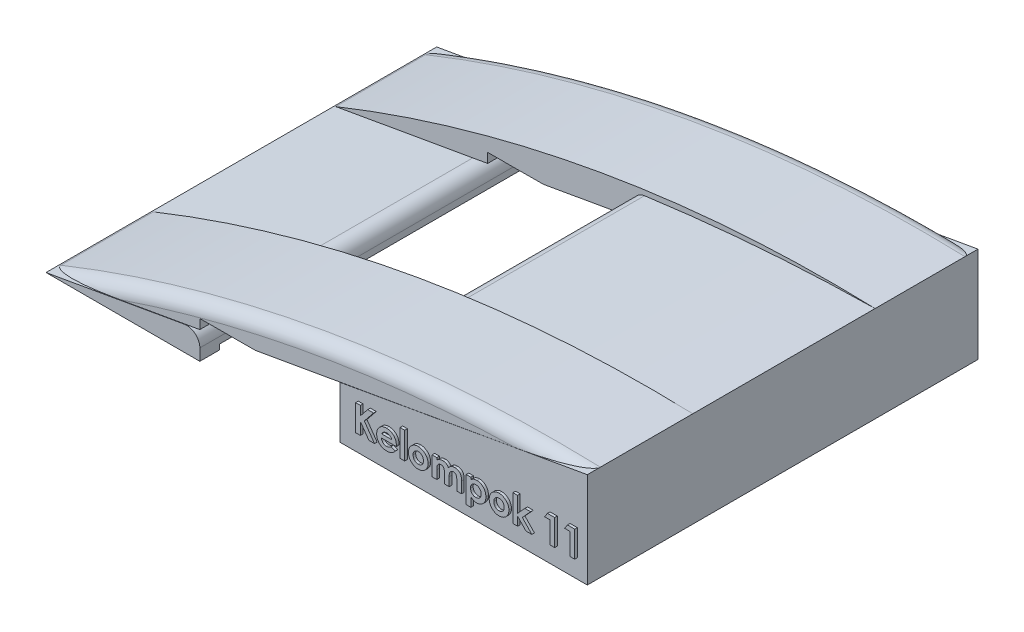
from build123d import *

# Parameters (mm, degrees)
BOSS_EXTRUDE2_DEPTH      = 150
BOSS_EXTRUDE2_DEPTH_BACK = 150
CUT_EXTRUDE2_DEPTH       = 135
CUT_EXTRUDE2_DEPTH_BACK  = 135
SKETCH3_W                = 234.9626354
SKETCH3_H                = 138.9202701
CUT_EXTRUDE3_DEPTH       = 135
CUT_EXTRUDE5_DEPTH       = 330
BOSS_EXTRUDE4_DEPTH      = 142
BOSS_EXTRUDE6_DEPTH      = 142
BOSS_EXTRUDE7_DEPTH      = 81
CUT_EXTRUDE6_DEPTH       = 300
BOSS_EXTRUDE8_DEPTH      = 79
CUT_EXTRUDE7_DEPTH       = 187
CUT_EXTRUDE7_DEPTH_BACK  = 212
BOSS_EXTRUDE9_DEPTH      = 186
FILLET1_R                = 10
FILLET2_R                = 10
FILLET3_R                = 10
FILLET4_R                = 10
SKETCH16_W               = 3.58974359
SKETCH16_H               = 20.512820513
BOSS_EXTRUDE11_DEPTH     = 2
SKETCH17_W               = 3.58974359
SKETCH17_H               = 20.512820513
BOSS_EXTRUDE12_DEPTH     = 2


with BuildPart() as part:
    # Sketch1 → Boss-Extrude2 (new, two sides: drawn at the far end of the back side and taken through both)
    with BuildSketch(Plane.XY.offset(-BOSS_EXTRUDE2_DEPTH_BACK)):
        Polygon((-209.307170195, -40.715866281), (206.361989113, -40.715866281), (206.361989113, 32.684133719), align=None)
    extrude(amount=BOSS_EXTRUDE2_DEPTH + BOSS_EXTRUDE2_DEPTH_BACK)

    # Sketch2 → Cut-Extrude2 (cut, two sides: drawn at the far end of the back side and taken through both)
    with BuildSketch(Plane.XY.offset(-CUT_EXTRUDE2_DEPTH_BACK)):
        Polygon((194.537370996, 15.364044392), (194.537370996, -28.035955608), (194.537370996, -40.715866281), (-112.107869233, -40.715866281), (-44.349609233, -28.035955608), align=None)
    extrude(amount=CUT_EXTRUDE2_DEPTH + CUT_EXTRUDE2_DEPTH_BACK, mode=Mode.SUBTRACT)

    # Sketch3 → Cut-Extrude3 (cut)
    with BuildSketch(Plane(origin=(0.643160465, -3.642261166, 0), x_dir=(0.9847646512869395, 0.17389244254915892, 0), z_dir=(-0.17389244254915892, 0.9847646512869396, 0))):
        with Locations((-95.717166207, 0.975734402)):
            Rectangle(SKETCH3_W, SKETCH3_H)
    extrude(amount=-CUT_EXTRUDE3_DEPTH, mode=Mode.SUBTRACT)

    # Sketch4 → Cut-Extrude5 (cut)
    with BuildSketch(Plane.XY.offset(150)):
        Polygon((-91.166181671, -19.854206561), (-91.166181671, -40.715866281), (16.315929345, -40.715866281), (16.315929345, -0.87472066), align=None)
    extrude(amount=-CUT_EXTRUDE5_DEPTH, mode=Mode.SUBTRACT)


with BuildPart() as cut_extrude5_piece_1:
    # of the separate pieces the step leaves, piece 1, a body of its own (cut_extrude5_pieces)
    add(part.part.solids().sort_by_distance((16.315929345, -40.715866281, 150))[0])

    # Sketch16 → Boss-Extrude11 (add)
    # profile 1 of 10: a face of its own
    with BuildSketch(Plane.XY.offset(150)):
        Polygon((30.467834805, -6.356957329), (34.057578395, -6.356957329), (34.057578395, -13.396220149), (39.730655318, -6.356957329), (44.261905318, -6.356957329), (37.134501472, -15.203111175), (44.955014293, -26.356957329), (40.632097626, -26.356957329), (34.057578395, -16.977950918), (34.057578395, -26.356957329), (30.467834805, -26.356957329), align=None)
    # profile 2 of 10: a face of its own
    with BuildSketch(Plane.XY.offset(150)):
        with BuildLine():
            Line((61.737866857, -19.946700918), (50.211424549, -19.946700918))
            add(Edge.make_bspline(
                [(50.211424549, -19.946700918), (50.234926034, -20.080631639), (50.281108307, -20.343816071), (50.381394753, -20.726114296), (50.509375299, -21.086385691), (50.662751924, -21.425111849), (50.838938699, -21.744083484), (51.044445977, -22.041804494), (51.276667082, -22.318011911), (51.534259376, -22.571505309), (51.812929262, -22.798640888), (52.111325295, -22.997626014), (52.4297554, -23.160781644), (52.764568897, -23.298304911), (53.118267612, -23.40723727), (53.491372101, -23.482365846), (53.88289332, -23.526744571), (54.149609536, -23.533163446), (54.28594378, -23.536444508)],
                knots=[0, 0, 0, 0, 1.091296461, 2.144483647, 3.168565212, 4.157007626, 5.126487748, 6.090021542, 7.05641414, 8.019231907, 8.98705074, 9.938580405, 10.892824166, 11.854447369, 12.841318655, 13.858982407, 14.905600794, 16, 16, 16, 16], degree=3))
            add(Edge.make_bspline(
                [(54.28594378, -23.536444508), (54.450508467, -23.532099841), (54.774584799, -23.523543913), (55.249359039, -23.447665537), (55.708534889, -23.333054586), (56.147766926, -23.16261848), (56.572142964, -22.95045549), (56.974676472, -22.68612651), (57.362334987, -22.377356096), (57.598852364, -22.139355979), (57.719437369, -22.018015021)],
                knots=[0, 0, 0, 0, 1.021034703, 2.010718019, 2.977989445, 3.954245119, 4.929443971, 5.918328161, 6.938689359, 8, 8, 8, 8], degree=3))
            Line((57.719437369, -22.018015021), (60.724245062, -23.448303482))
            add(Edge.make_bspline(
                [(60.724245062, -23.448303482), (60.629640445, -23.579032543), (60.442184877, -23.838067368), (60.136169952, -24.202596269), (59.816823892, -24.542716521), (59.48390853, -24.856191103), (59.137001644, -25.142126734), (58.777068247, -25.404006629), (58.398848059, -25.634799418), (58.009903524, -25.845670715), (57.602194438, -26.0264497), (57.176849115, -26.180611637), (56.735669128, -26.319972717), (56.273083328, -26.426158225), (55.792943663, -26.510213807), (55.294101545, -26.569904406), (54.776622719, -26.606772429), (54.424895376, -26.611143088), (54.245879677, -26.613367585)],
                knots=[0, 0, 0, 0, 1.028154879, 2.037251081, 3.030720504, 4.000128189, 4.949298328, 5.894184978, 6.834267904, 7.770992897, 8.712077017, 9.673380525, 10.653304757, 11.658697181, 12.695551717, 13.758623199, 14.859225354, 16, 16, 16, 16], degree=3))
            add(Edge.make_bspline(
                [(54.245879677, -26.613367585), (53.970466963, -26.607752748), (53.431087037, -26.596756414), (52.642146389, -26.494694698), (51.892871595, -26.32546537), (51.181146963, -26.095424091), (50.510049042, -25.791697535), (49.879245703, -25.420214762), (49.282434319, -24.988097841), (48.73785081, -24.486277787), (48.241719166, -23.940076491), (47.805947978, -23.353493598), (47.441300852, -22.73062734), (47.141845299, -22.075599977), (46.909098041, -21.386734895), (46.741300768, -20.663731488), (46.638439029, -19.906935075), (46.62732945, -19.391472237), (46.621680959, -19.129393226)],
                knots=[0, 0, 0, 0, 1.103565453, 2.161269334, 3.182010356, 4.179077853, 5.15417608, 6.128274628, 7.109042802, 8.101804412, 9.090965879, 10.063106201, 11.02526161, 11.978650795, 12.945248442, 13.93468508, 14.949922959, 16, 16, 16, 16], degree=3))
            add(Edge.make_bspline(
                [(46.621680959, -19.129393226), (46.627385044, -18.860654451), (46.638607573, -18.331922981), (46.740415129, -17.557651793), (46.909561943, -16.818892354), (47.142990038, -16.114627316), (47.437902813, -15.442654039), (47.807189448, -14.808851484), (48.241502916, -14.211013095), (48.735847256, -13.651935621), (49.282737789, -13.147307121), (49.863860649, -12.697582281), (50.485745348, -12.322841693), (51.141357833, -12.02005153), (51.826504571, -11.774042166), (52.5491049, -11.610343481), (53.303660933, -11.500429612), (53.819458822, -11.490307231), (54.081616857, -11.485162457)],
                knots=[0, 0, 0, 0, 1.079208495, 2.12329425, 3.130605359, 4.119693003, 5.099659317, 6.073216462, 7.060498243, 8.06384408, 9.066070512, 10.045757761, 11.010926815, 11.975797609, 12.942977511, 13.929384301, 14.947594487, 16, 16, 16, 16], degree=3))
            add(Edge.make_bspline(
                [(54.081616857, -11.485162457), (54.358348984, -11.490864403), (54.901683997, -11.502059588), (55.696119373, -11.603292587), (56.450369262, -11.773553855), (57.16764719, -12.00160601), (57.838793224, -12.313005017), (58.478554478, -12.675346188), (59.071585849, -13.116803644), (59.624208419, -13.616167953), (60.12306323, -14.170195347), (60.559117609, -14.772038784), (60.930146216, -15.415824625), (61.230868585, -16.104163559), (61.463376855, -16.834989124), (61.631329454, -17.6073522), (61.733406603, -18.424190485), (61.744309458, -18.983526475), (61.749886087, -19.269617585)],
                knots=[0, 0, 0, 0, 1.080001299, 2.120471247, 3.119684163, 4.095710327, 5.052285597, 6.002875087, 6.961153713, 7.931888285, 8.906493152, 9.865905668, 10.82813294, 11.801621613, 12.7925306, 13.817193356, 14.883530496, 16, 16, 16, 16], degree=3))
            Line((61.749886087, -19.269617585), (61.737866857, -19.946700918))
        make_face()
        with BuildLine():
            add(Edge.make_bspline(
                [(58.160142498, -17.126188098), (58.092401841, -16.943383505), (57.957715768, -16.579920353), (57.653465535, -16.07842989), (57.249735211, -15.644118781), (56.780167879, -15.259619713), (56.243657802, -14.947536251), (55.657111348, -14.72157769), (55.027942355, -14.586090101), (54.595107991, -14.570199787), (54.374084805, -14.562085534)],
                knots=[0, 0, 0, 0, 0.954238005, 1.897273737, 2.851915805, 3.847685534, 4.862635127, 5.880135777, 6.917509367, 8, 8, 8, 8], degree=3))
            add(Edge.make_bspline(
                [(54.374084805, -14.562085534), (54.1326915, -14.569880262), (53.660817853, -14.585117333), (52.980172242, -14.747169179), (52.33813627, -14.989026719), (51.959628249, -15.238386978), (51.769918139, -15.363367585)],
                knots=[0, 0, 0, 0, 1.044195649, 2.041185066, 3.018232172, 4, 4, 4, 4], degree=3))
            add(Edge.make_bspline(
                [(51.769918139, -15.363367585), (51.651553198, -15.458555553), (51.399205197, -15.661491434), (51.07148012, -16.066329252), (50.748668192, -16.556496968), (50.565131813, -16.928813978), (50.467834805, -17.126188098)],
                knots=[0, 0, 0, 0, 0.82159062, 1.751589201, 2.808063854, 4, 4, 4, 4], degree=3))
            Line((50.467834805, -17.126188098), (58.160142498, -17.126188098))
        make_face(mode=Mode.SUBTRACT)
    # profile 3 of 10: a face of its own
    with BuildSketch(Plane.XY.offset(150)):
        with Locations((66.365270703, -16.100547072)):
            Rectangle(SKETCH16_W, SKETCH16_H)
    # profile 4 of 10: a face of its own
    with BuildSketch(Plane.XY.offset(150)):
        with BuildLine():
            add(Edge.make_bspline(
                [(78.456616857, -11.485162457), (78.626333003, -11.488182672), (78.962447876, -11.494164066), (79.46304899, -11.54395371), (79.954898443, -11.625187568), (80.440823319, -11.730371233), (80.916311351, -11.877749281), (81.383856418, -12.05450646), (81.847638965, -12.257444373), (82.296148003, -12.499011473), (82.732623675, -12.761013023), (83.146428587, -13.050022231), (83.534126377, -13.363769026), (83.902914034, -13.694978943), (84.235605458, -14.05807178), (84.553461418, -14.435552203), (84.839308928, -14.840944017), (85.103962547, -15.264368761), (85.33958176, -15.703377853), (85.544173714, -16.15491739), (85.721740294, -16.612744517), (85.860771368, -17.082435883), (85.975876282, -17.557797982), (86.048515665, -18.044656023), (86.100157229, -18.53800875), (86.105947885, -18.870174404), (86.108860446, -19.03724579)],
                knots=[0, 0, 0, 0, 1.022364134, 2.024744242, 3.027414945, 4.024939316, 5.017584196, 6.023349371, 7.035562955, 8.064994934, 9.090267829, 10.101425541, 11.102933353, 12.093946398, 13.084502048, 14.067315274, 15.065326281, 16.070028806, 17.074376865, 18.064572984, 19.055292013, 20.030201733, 21.013838017, 21.999348303, 22.993720005, 24, 24, 24, 24], degree=3))
            add(Edge.make_bspline(
                [(86.108860446, -19.03724579), (86.10578672, -19.205622422), (86.099675455, -19.540393335), (86.050383993, -20.038386654), (85.968839198, -20.527534161), (85.863251833, -21.010717508), (85.716425316, -21.481753903), (85.544874202, -21.947586606), (85.334288462, -22.401866145), (85.101470409, -22.849548281), (84.835115179, -23.277459095), (84.549515102, -23.686911957), (84.23299048, -24.067164993), (83.902962342, -24.43001091), (83.543776708, -24.763179881), (83.161166851, -25.072081683), (82.758445109, -25.360492778), (82.332715488, -25.621646498), (81.889430874, -25.851112959), (81.436067179, -26.0579957), (80.969973384, -26.230240353), (80.492114095, -26.370701125), (80.002199507, -26.479456384), (79.501311224, -26.553335126), (78.990527975, -26.604716939), (78.646382334, -26.610465473), (78.472642498, -26.613367585)],
                knots=[0, 0, 0, 0, 1.012026251, 2.012137606, 3.004615893, 3.992048833, 4.982446996, 5.968083444, 6.973977695, 7.990229942, 8.999482246, 10.001782172, 10.988562221, 11.971415814, 12.948383116, 13.930088534, 14.925840678, 15.924049238, 16.929462851, 17.924729459, 18.917889337, 19.913673841, 20.916777188, 21.931792057, 22.95587778, 24, 24, 24, 24], degree=3))
            add(Edge.make_bspline(
                [(78.472642498, -26.613367585), (78.218599429, -26.60591092), (77.717876672, -26.59121372), (76.980430434, -26.490541743), (76.271988034, -26.317258876), (75.591395075, -26.075706381), (74.937767449, -25.766165859), (74.316809495, -25.383062459), (73.722344374, -24.933938386), (73.164668671, -24.422589678), (72.653762179, -23.861593841), (72.207423889, -23.262734204), (71.828446561, -22.634986665), (71.51717116, -21.97763538), (71.276930025, -21.289778945), (71.103434936, -20.573473809), (71.002639876, -19.826706542), (70.988066979, -19.319331319), (70.980655318, -19.061284252)],
                knots=[0, 0, 0, 0, 1.029999031, 2.030143771, 3.011211297, 3.982305373, 4.953580601, 5.938004764, 6.935448627, 7.970290061, 9.001484052, 10.007591832, 10.993831261, 11.969999897, 12.951306496, 13.942897864, 14.953773953, 16, 16, 16, 16], degree=3))
            add(Edge.make_bspline(
                [(70.980655318, -19.061284252), (70.988325446, -18.785746551), (71.003400929, -18.244182716), (71.1231069, -17.450779357), (71.314264422, -16.691133242), (71.588659003, -15.967369341), (71.939173948, -15.27815277), (72.367073257, -14.624937164), (72.874471637, -14.00757456), (73.263037193, -13.634172493), (73.460623267, -13.444297072)],
                knots=[0, 0, 0, 0, 1.043912699, 2.05178951, 3.033892, 4.007821512, 4.978932272, 5.95884105, 6.962068106, 8, 8, 8, 8], degree=3))
            add(Edge.make_bspline(
                [(73.460623267, -13.444297072), (73.64192824, -13.286911706), (73.99960542, -12.976422959), (74.580713117, -12.582618885), (75.175701826, -12.242492308), (75.791702743, -11.962845002), (76.430433118, -11.751995445), (77.088619823, -11.598515832), (77.766125995, -11.504244156), (78.225283572, -11.491555347), (78.456616857, -11.485162457)],
                knots=[0, 0, 0, 0, 1.048115528, 2.067714963, 3.060638214, 4.039924844, 5.017819947, 5.994373833, 6.98952318, 8, 8, 8, 8], degree=3))
        make_face()
        with BuildLine():
            add(Edge.make_bspline(
                [(78.536745062, -14.81849579), (78.397760041, -14.823115192), (78.124166532, -14.832208534), (77.721429697, -14.881010072), (77.340516958, -14.981033016), (76.973862678, -15.108234825), (76.627953006, -15.278349323), (76.293314708, -15.477422489), (75.987348241, -15.726538058), (75.695246908, -15.999799614), (75.430084006, -16.303249237), (75.204140035, -16.633857375), (75.002254092, -16.978975652), (74.849174218, -17.35123928), (74.722485989, -17.740473212), (74.636744915, -18.152966285), (74.577075114, -18.584110727), (74.572645477, -18.879447625), (74.570398908, -19.02923297)],
                knots=[0, 0, 0, 0, 1.030650113, 2.02884584, 2.99876339, 3.944280128, 4.900564847, 5.851248946, 6.823638398, 7.81794922, 8.81432732, 9.802856497, 10.78262424, 11.771747962, 12.779760563, 13.812642396, 14.89064281, 16, 16, 16, 16], degree=3))
            add(Edge.make_bspline(
                [(74.570398908, -19.02923297), (74.573027699, -19.184300499), (74.578165167, -19.487350206), (74.631364721, -19.92984353), (74.71909254, -20.349766762), (74.843726277, -20.746471211), (75.000474245, -21.122804372), (75.192785825, -21.476654762), (75.42269065, -21.805894816), (75.683346921, -22.110119098), (75.968754405, -22.386266846), (76.281481613, -22.62324651), (76.608432708, -22.829150386), (76.957142416, -22.994522978), (77.322658062, -23.122204037), (77.706064709, -23.216211306), (78.10937716, -23.266857865), (78.384372513, -23.275581728), (78.524725831, -23.280034252)],
                knots=[0, 0, 0, 0, 1.141730614, 2.231293227, 3.276944405, 4.297399982, 5.28939179, 6.275415646, 7.257752684, 8.24146775, 9.222424823, 10.176631434, 11.126518621, 12.063689483, 13.012557477, 13.974037417, 14.965980454, 16, 16, 16, 16], degree=3))
            add(Edge.make_bspline(
                [(78.524725831, -23.280034252), (78.665149346, -23.276085065), (78.940460955, -23.268342366), (79.344247021, -23.210361778), (79.729611624, -23.119111762), (80.098249059, -22.990331796), (80.447178858, -22.821419492), (80.777736754, -22.614530545), (81.092830708, -22.374254707), (81.382068388, -22.092896576), (81.649810177, -21.787723527), (81.884603712, -21.456745438), (82.080806044, -21.102894957), (82.241727089, -20.728398515), (82.366605151, -20.333770854), (82.452880618, -19.917545193), (82.512582321, -19.481011445), (82.516911778, -19.18168562), (82.519116857, -19.02923297)],
                knots=[0, 0, 0, 0, 1.031504075, 2.022346795, 2.991027682, 3.937587355, 4.885570121, 5.833146507, 6.798790848, 7.791235734, 8.792807298, 9.778388351, 10.766749885, 11.760164525, 12.768777521, 13.802286646, 14.880660483, 16, 16, 16, 16], degree=3))
            add(Edge.make_bspline(
                [(82.519116857, -19.02923297), (82.516454624, -18.876833602), (82.51123046, -18.577776606), (82.458027114, -18.140652453), (82.371160232, -17.725772149), (82.244918994, -17.3349072), (82.089102714, -16.963598454), (81.896658209, -16.613746503), (81.665619566, -16.287074457), (81.403696172, -15.985202138), (81.114010252, -15.712929371), (80.806712742, -15.470128159), (80.474776694, -15.269312903), (80.124429426, -15.103769446), (79.754738833, -14.976407387), (79.366119953, -14.881867354), (78.95738179, -14.831941474), (78.678422691, -14.823024526), (78.536745062, -14.81849579)],
                knots=[0, 0, 0, 0, 1.123894411, 2.205445421, 3.243160173, 4.246488011, 5.231014757, 6.210004299, 7.185865357, 8.177612767, 9.153374344, 10.115157457, 11.061423229, 12.009021698, 12.96873347, 13.94135618, 14.954456845, 16, 16, 16, 16], degree=3))
        make_face(mode=Mode.SUBTRACT)
    # profile 5 of 10: a face of its own
    with BuildSketch(Plane.XY.offset(150)):
        with BuildLine():
            Line((89.185783523, -11.741572713), (92.775527113, -11.741572713))
            Line((92.775527113, -11.741572713), (92.775527113, -13.488367585))
            add(Edge.make_bspline(
                [(92.775527113, -13.488367585), (92.935197084, -13.327214699), (93.249574133, -13.009917913), (93.770558402, -12.60200437), (94.313997749, -12.253187895), (94.886477796, -11.970799005), (95.486598281, -11.755174693), (96.111514947, -11.597168377), (96.764437624, -11.503949599), (97.20898972, -11.491494256), (97.434982241, -11.485162457)],
                knots=[0, 0, 0, 0, 1.041528618, 2.050684245, 3.032913108, 4.004406485, 4.976926473, 5.95771665, 6.961784757, 8, 8, 8, 8], degree=3))
            add(Edge.make_bspline(
                [(97.434982241, -11.485162457), (97.661273152, -11.492280314), (98.106719489, -11.506291585), (98.756622596, -11.634507844), (99.372301954, -11.842815942), (99.946983642, -12.13973354), (100.484821123, -12.50641134), (100.961987843, -12.961793072), (101.391495232, -13.487750978), (101.620439205, -13.88538081), (101.737866857, -14.089329123)],
                knots=[0, 0, 0, 0, 1.023965777, 2.015643508, 2.987309376, 3.958410333, 4.93654923, 5.924956801, 6.93568961, 8, 8, 8, 8], degree=3))
            add(Edge.make_bspline(
                [(101.737866857, -14.089329123), (101.889128846, -13.884825992), (102.186013683, -13.483443735), (102.712269098, -12.959393689), (103.281308209, -12.506363856), (103.904140617, -12.137026467), (104.564226048, -11.843829421), (105.258676054, -11.635281823), (105.981194515, -11.506505869), (106.472907979, -11.492336032), (106.721841216, -11.485162457)],
                knots=[0, 0, 0, 0, 1.041189987, 2.043563759, 3.033412161, 4.015238574, 5.00275396, 5.986226558, 6.980513695, 8, 8, 8, 8], degree=3))
            add(Edge.make_bspline(
                [(106.721841216, -11.485162457), (106.978959688, -11.492611108), (107.479674012, -11.507116665), (108.20528097, -11.649825949), (108.884899692, -11.870333206), (109.503510793, -12.191225233), (110.062878614, -12.571334548), (110.539527475, -13.020449565), (110.935102479, -13.522898743), (111.192672533, -13.992063678), (111.359184653, -14.406859206), (111.45972615, -14.767809035), (111.553763557, -15.170855173), (111.621320024, -15.621415125), (111.684381005, -16.115253976), (111.720990384, -16.655654934), (111.745874158, -17.240797513), (111.74851713, -17.645654478), (111.749886087, -17.855354764)],
                knots=[0, 0, 0, 0, 1.321991808, 2.574456155, 3.791773975, 4.987670122, 6.148905103, 7.262530793, 8.344737981, 9.427709016, 10.004683293, 10.642050061, 11.354108788, 12.133887687, 12.985666279, 13.916212488, 14.92067847, 16, 16, 16, 16], degree=3))
            Line((111.749886087, -17.855354764), (111.749886087, -26.356957329))
            Line((111.749886087, -26.356957329), (108.160142498, -26.356957329))
            Line((108.160142498, -26.356957329), (108.160142498, -19.017213739))
            add(Edge.make_bspline(
                [(108.160142498, -19.017213739), (108.157154716, -18.820889241), (108.151419939, -18.444062108), (108.127039194, -17.90357553), (108.072464655, -17.413400844), (108.008496303, -16.970822943), (107.916956357, -16.578188425), (107.805340016, -16.234550795), (107.675865737, -15.939415399), (107.519529448, -15.692812997), (107.34443262, -15.485134822), (107.149662659, -15.307113498), (106.937250339, -15.155226081), (106.705269829, -15.025763643), (106.447643836, -14.938205633), (106.173069406, -14.869504495), (105.879397911, -14.822718528), (105.676353506, -14.819929285), (105.572001472, -14.81849579)],
                knots=[0, 0, 0, 0, 1.669139205, 3.203761885, 4.596586177, 5.860166715, 7.002923539, 8.018877315, 8.928339525, 9.734594377, 10.491888885, 11.231098709, 11.971440889, 12.708030942, 13.480072485, 14.275788656, 15.113863979, 16, 16, 16, 16], degree=3))
            add(Edge.make_bspline(
                [(105.572001472, -14.81849579), (105.411196465, -14.824055236), (105.095648638, -14.834964542), (104.635831141, -14.93921518), (104.203139489, -15.109653814), (103.799194721, -15.34152048), (103.432688833, -15.631117564), (103.112088958, -15.97460732), (102.847318172, -16.373969307), (102.66403738, -16.744497124), (102.549509907, -17.079528723), (102.468721184, -17.366456382), (102.405749586, -17.690929123), (102.356461262, -18.049660789), (102.30917487, -18.444679325), (102.285976431, -18.875485217), (102.262237349, -19.341479971), (102.262546382, -19.663542296), (102.2627066, -19.830515021)],
                knots=[0, 0, 0, 0, 1.129913425, 2.217230253, 3.297175357, 4.391411011, 5.481605898, 6.571841268, 7.681894157, 8.841607612, 9.468549532, 10.170608623, 10.93710061, 11.791434153, 12.717934886, 13.734733707, 14.825576123, 16, 16, 16, 16], degree=3))
            Line((102.2627066, -19.830515021), (102.2627066, -26.356957329))
            Line((102.2627066, -26.356957329), (98.67296301, -26.356957329))
            Line((98.67296301, -26.356957329), (98.67296301, -19.34974579))
            add(Edge.make_bspline(
                [(98.67296301, -19.34974579), (98.672661615, -19.193475747), (98.672081827, -18.892862802), (98.654654554, -18.458771957), (98.631577441, -18.057948591), (98.599226015, -17.689274737), (98.561915016, -17.353208935), (98.508066646, -17.051589697), (98.451493965, -16.782755011), (98.354499338, -16.47736683), (98.217821437, -16.138945617), (98.013622655, -15.780068765), (97.766718438, -15.479593978), (97.483349275, -15.235182921), (97.163129962, -15.048961309), (96.814172652, -14.910435573), (96.42981422, -14.835663633), (96.165247573, -14.824339168), (96.028732241, -14.81849579)],
                knots=[0, 0, 0, 0, 1.256487322, 2.417074606, 3.49288742, 4.484586665, 5.393016842, 6.210437544, 6.947749329, 7.599905853, 8.784490193, 9.876739139, 10.906602197, 11.896672079, 12.869113195, 13.872201355, 14.902064413, 16, 16, 16, 16], degree=3))
            add(Edge.make_bspline(
                [(96.028732241, -14.81849579), (95.874481664, -14.823731322), (95.568987105, -14.834100337), (95.123987611, -14.945472033), (94.698526826, -15.112783438), (94.301964453, -15.351117215), (93.940979999, -15.647529402), (93.623590011, -16.000789434), (93.360210697, -16.410478288), (93.176116355, -16.791226589), (93.06325883, -17.134616763), (92.980297815, -17.42899477), (92.91966916, -17.760613131), (92.869083913, -18.125748363), (92.822077473, -18.524831466), (92.798783047, -18.959617451), (92.775067422, -19.429624397), (92.775370189, -19.754355024), (92.775527113, -19.922662457)],
                knots=[0, 0, 0, 0, 1.07893236, 2.136834559, 3.195274846, 4.273923004, 5.364443877, 6.458052972, 7.587287137, 8.767908, 9.410170275, 10.118584836, 10.909717261, 11.770069756, 12.702352573, 13.724628867, 14.820678298, 16, 16, 16, 16], degree=3))
            Line((92.775527113, -19.922662457), (92.775527113, -26.356957329))
            Line((92.775527113, -26.356957329), (89.185783523, -26.356957329))
            Line((89.185783523, -26.356957329), (89.185783523, -11.741572713))
        make_face()
    # profile 6 of 10: a face of its own
    with BuildSketch(Plane.XY.offset(150)):
        with BuildLine():
            Line((118.929373267, -11.741572713), (118.929373267, -13.388207329))
            add(Edge.make_bspline(
                [(118.929373267, -13.388207329), (119.096029289, -13.23508679), (119.423324518, -12.934373851), (119.959195351, -12.549371527), (120.509883522, -12.21871427), (121.085507343, -11.95275985), (121.678167146, -11.74320882), (122.293173506, -11.595968718), (122.926004871, -11.498859919), (123.356096038, -11.48975173), (123.572802754, -11.485162457)],
                knots=[0, 0, 0, 0, 1.054376801, 2.070687235, 3.070225973, 4.045259405, 5.022040922, 5.996139433, 6.99033025, 8, 8, 8, 8], degree=3))
            add(Edge.make_bspline(
                [(123.572802754, -11.485162457), (123.808214224, -11.490801155), (124.271898433, -11.501907561), (124.954121521, -11.605601814), (125.607909166, -11.773216439), (126.235754432, -12.007252139), (126.834312228, -12.311108408), (127.41030778, -12.67491892), (127.953807366, -13.11369649), (128.465075199, -13.61068566), (128.93801068, -14.155422708), (129.349377452, -14.747667493), (129.692030008, -15.379624937), (129.982444886, -16.043823982), (130.194401328, -16.75128015), (130.357759669, -17.492503389), (130.448792104, -18.273764606), (130.461404961, -18.805989597), (130.467834805, -19.077309893)],
                knots=[0, 0, 0, 0, 0.985987466, 1.942075377, 2.884088208, 3.810275091, 4.743821533, 5.692411115, 6.659945104, 7.665215984, 8.677116751, 9.678438675, 10.680260931, 11.685531812, 12.710472044, 13.769734641, 14.863044265, 16, 16, 16, 16], degree=3))
            add(Edge.make_bspline(
                [(130.467834805, -19.077309893), (130.461749386, -19.339342171), (130.449753682, -19.855865567), (130.352835958, -20.614164415), (130.188568532, -21.338554779), (129.958134624, -22.029297542), (129.665191045, -22.688575571), (129.307633186, -23.315934585), (128.883375337, -23.909183235), (128.398339133, -24.460329862), (127.868366594, -24.959434105), (127.316173196, -25.407229842), (126.730761063, -25.774163333), (126.126764189, -26.084066777), (125.494667334, -26.321043944), (124.838787998, -26.487073084), (124.160164933, -26.598073865), (123.698783904, -26.608218904), (123.464629677, -26.613367585)],
                knots=[0, 0, 0, 0, 1.098553145, 2.165490463, 3.199345634, 4.208780719, 5.21409072, 6.219899742, 7.23156933, 8.267303578, 9.293302409, 10.281606823, 11.243293419, 12.184993323, 13.124258899, 14.066907486, 15.018941492, 16, 16, 16, 16], degree=3))
            add(Edge.make_bspline(
                [(123.464629677, -26.613367585), (123.255971162, -26.608307202), (122.844926443, -26.598338554), (122.24049475, -26.509455392), (121.656606872, -26.376694161), (121.092490441, -26.176873708), (120.541803782, -25.911713647), (119.995168014, -25.581504734), (119.451319113, -25.178098338), (119.107088037, -24.866951044), (118.929373267, -24.706316303)],
                knots=[0, 0, 0, 0, 0.990856396, 1.951927477, 2.896945079, 3.83213376, 4.788585491, 5.796263726, 6.862286081, 8, 8, 8, 8], degree=3))
            Line((118.929373267, -24.706316303), (118.929373267, -31.741572713))
            Line((118.929373267, -31.741572713), (115.339629677, -31.741572713))
            Line((115.339629677, -31.741572713), (115.339629677, -11.741572713))
            Line((115.339629677, -11.741572713), (118.929373267, -11.741572713))
        make_face()
        with BuildLine():
            add(Edge.make_bspline(
                [(122.795559164, -14.81849579), (122.64987666, -14.822975627), (122.364259756, -14.831758543), (121.944922121, -14.882093397), (121.547592327, -14.976798792), (121.1662293, -15.099546682), (120.805662191, -15.265237053), (120.462941151, -15.466087843), (120.141001621, -15.705587078), (119.838172741, -15.974250884), (119.566056917, -16.27649817), (119.324305612, -16.599465072), (119.123740702, -16.947357228), (118.956547989, -17.315763405), (118.830408392, -17.708669721), (118.736849356, -18.122733715), (118.68600595, -18.55922431), (118.67737942, -18.856836425), (118.67296301, -19.009200918)],
                knots=[0, 0, 0, 0, 1.060469436, 2.079096586, 3.066888298, 4.028858836, 4.99004353, 5.948472697, 6.914558426, 7.905691313, 8.889602648, 9.869280844, 10.836099585, 11.806137001, 12.808075328, 13.83377171, 14.890985086, 16, 16, 16, 16], degree=3))
            add(Edge.make_bspline(
                [(118.67296301, -19.009200918), (118.677434991, -19.164231914), (118.686211447, -19.468486919), (118.736631007, -19.914285091), (118.829533354, -20.336644699), (118.958329689, -20.736523342), (119.122677393, -21.113972902), (119.323004672, -21.470392638), (119.567417033, -21.797968231), (119.836543564, -22.108184475), (120.14124491, -22.38044306), (120.461734095, -22.624621559), (120.805578927, -22.82577174), (121.1678692, -22.988750933), (121.545855885, -23.12418575), (121.945171707, -23.215698916), (122.364193529, -23.266967253), (122.64985429, -23.275620536), (122.795559164, -23.280034252)],
                knots=[0, 0, 0, 0, 1.117193555, 2.192540452, 3.22680955, 4.227918444, 5.21468246, 6.188555072, 7.166222992, 8.154674427, 9.142376254, 10.104580718, 11.053462639, 12.005072638, 12.963662044, 13.941614018, 14.950094269, 16, 16, 16, 16], degree=3))
            add(Edge.make_bspline(
                [(122.795559164, -23.280034252), (122.935964069, -23.275934044), (123.21388524, -23.267817986), (123.620530996, -23.21118698), (124.011418878, -23.118646287), (124.383487717, -22.986742324), (124.739002441, -22.815003499), (125.081199555, -22.614040647), (125.398265127, -22.362952568), (125.702638169, -22.086985333), (125.974970724, -21.775773662), (126.219285756, -21.445152251), (126.424517644, -21.092170237), (126.587466925, -20.715657078), (126.722181742, -20.322744482), (126.814155798, -19.906240788), (126.864758237, -19.469863591), (126.873602735, -19.17225371), (126.878091216, -19.021220149)],
                knots=[0, 0, 0, 0, 1.021711385, 2.02240246, 2.981887075, 3.941027022, 4.888772411, 5.852236371, 6.822344989, 7.82661704, 8.838806642, 9.826383926, 10.814965113, 11.80282933, 12.807900643, 13.833672313, 14.900613836, 16, 16, 16, 16], degree=3))
            add(Edge.make_bspline(
                [(126.878091216, -19.021220149), (126.873531056, -18.871545381), (126.864546266, -18.576644183), (126.814980057, -18.143900839), (126.719464861, -17.733452393), (126.598864767, -17.341945779), (126.430375627, -16.974477396), (126.231154206, -16.626700148), (125.996733294, -16.297563949), (125.724794937, -15.995953865), (125.426526489, -15.721510357), (125.108129999, -15.47876281), (124.770855843, -15.272115484), (124.410111082, -15.109150661), (124.034408725, -14.975065732), (123.638007256, -14.882706261), (123.222921942, -14.831589363), (122.939926709, -14.822918934), (122.795559164, -14.81849579)],
                knots=[0, 0, 0, 0, 1.094680664, 2.156827393, 3.177782763, 4.17210342, 5.146667393, 6.126451192, 7.099203661, 8.094961544, 9.09004898, 10.058676268, 11.018205477, 11.974998356, 12.947750825, 13.930643515, 14.944335875, 16, 16, 16, 16], degree=3))
        make_face(mode=Mode.SUBTRACT)
    # profile 7 of 10: a face of its own
    with BuildSketch(Plane.XY.offset(150)):
        with BuildLine():
            add(Edge.make_bspline(
                [(140.507898908, -11.485162457), (140.677615055, -11.488182672), (141.013729928, -11.494164066), (141.514331042, -11.54395371), (142.006180494, -11.625187568), (142.49210537, -11.730371233), (142.967593403, -11.877749281), (143.435138469, -12.05450646), (143.898921017, -12.257444373), (144.347430055, -12.499011473), (144.783905726, -12.761013023), (145.197710639, -13.050022231), (145.585408428, -13.363769026), (145.954196085, -13.694978943), (146.28688751, -14.05807178), (146.604743469, -14.435552203), (146.890590979, -14.840944017), (147.155244598, -15.264368761), (147.390863811, -15.703377853), (147.595455765, -16.15491739), (147.773022345, -16.612744517), (147.912053419, -17.082435883), (148.027158334, -17.557797982), (148.099797716, -18.044656023), (148.15143928, -18.53800875), (148.157229936, -18.870174404), (148.160142498, -19.03724579)],
                knots=[0, 0, 0, 0, 1.022364134, 2.024744242, 3.027414945, 4.024939316, 5.017584196, 6.023349371, 7.035562955, 8.064994934, 9.090267829, 10.101425541, 11.102933353, 12.093946398, 13.084502048, 14.067315274, 15.065326281, 16.070028806, 17.074376865, 18.064572984, 19.055292013, 20.030201733, 21.013838017, 21.999348303, 22.993720005, 24, 24, 24, 24], degree=3))
            add(Edge.make_bspline(
                [(148.160142498, -19.03724579), (148.157068771, -19.205622422), (148.150957507, -19.540393335), (148.101666044, -20.038386654), (148.02012125, -20.527534161), (147.914533884, -21.010717508), (147.767707367, -21.481753903), (147.596156253, -21.947586606), (147.385570513, -22.401866145), (147.15275246, -22.849548281), (146.88639723, -23.277459095), (146.600797153, -23.686911957), (146.284272531, -24.067164993), (145.954244394, -24.43001091), (145.595058759, -24.763179881), (145.212448902, -25.072081683), (144.80972716, -25.360492778), (144.38399754, -25.621646498), (143.940712925, -25.851112959), (143.48734923, -26.0579957), (143.021255435, -26.230240353), (142.543396146, -26.370701125), (142.053481558, -26.479456384), (141.552593276, -26.553335126), (141.041810026, -26.604716939), (140.697664386, -26.610465473), (140.523924549, -26.613367585)],
                knots=[0, 0, 0, 0, 1.012026251, 2.012137606, 3.004615893, 3.992048833, 4.982446996, 5.968083444, 6.973977695, 7.990229942, 8.999482246, 10.001782172, 10.988562221, 11.971415814, 12.948383116, 13.930088534, 14.925840678, 15.924049238, 16.929462851, 17.924729459, 18.917889337, 19.913673841, 20.916777188, 21.931792057, 22.95587778, 24, 24, 24, 24], degree=3))
            add(Edge.make_bspline(
                [(140.523924549, -26.613367585), (140.26988148, -26.60591092), (139.769158723, -26.59121372), (139.031712485, -26.490541743), (138.323270086, -26.317258876), (137.642677126, -26.075706381), (136.9890495, -25.766165859), (136.368091547, -25.383062459), (135.773626426, -24.933938386), (135.215950723, -24.422589678), (134.705044231, -23.861593841), (134.258705941, -23.262734204), (133.879728612, -22.634986665), (133.568453212, -21.97763538), (133.328212077, -21.289778945), (133.154716987, -20.573473809), (133.053921928, -19.826706542), (133.039349031, -19.319331319), (133.031937369, -19.061284252)],
                knots=[0, 0, 0, 0, 1.029999031, 2.030143771, 3.011211297, 3.982305373, 4.953580601, 5.938004764, 6.935448627, 7.970290061, 9.001484052, 10.007591832, 10.993831261, 11.969999897, 12.951306496, 13.942897864, 14.953773953, 16, 16, 16, 16], degree=3))
            add(Edge.make_bspline(
                [(133.031937369, -19.061284252), (133.039607498, -18.785746551), (133.054682981, -18.244182716), (133.174388952, -17.450779357), (133.365546473, -16.691133242), (133.639941055, -15.967369341), (133.990455999, -15.27815277), (134.418355308, -14.624937164), (134.925753688, -14.00757456), (135.314319244, -13.634172493), (135.511905318, -13.444297072)],
                knots=[0, 0, 0, 0, 1.043912699, 2.05178951, 3.033892, 4.007821512, 4.978932272, 5.95884105, 6.962068106, 8, 8, 8, 8], degree=3))
            add(Edge.make_bspline(
                [(135.511905318, -13.444297072), (135.693210291, -13.286911706), (136.050887471, -12.976422959), (136.631995169, -12.582618885), (137.226983878, -12.242492308), (137.842984794, -11.962845002), (138.48171517, -11.751995445), (139.139901874, -11.598515832), (139.817408046, -11.504244156), (140.276565623, -11.491555347), (140.507898908, -11.485162457)],
                knots=[0, 0, 0, 0, 1.048115528, 2.067714963, 3.060638214, 4.039924844, 5.017819947, 5.994373833, 6.98952318, 8, 8, 8, 8], degree=3))
        make_face()
        with BuildLine():
            add(Edge.make_bspline(
                [(140.588027113, -14.81849579), (140.449042092, -14.823115192), (140.175448583, -14.832208534), (139.772711749, -14.881010072), (139.39179901, -14.981033016), (139.025144729, -15.108234825), (138.679235057, -15.278349323), (138.34459676, -15.477422489), (138.038630292, -15.726538058), (137.746528959, -15.999799614), (137.481366058, -16.303249237), (137.255422086, -16.633857375), (137.053536143, -16.978975652), (136.900456269, -17.35123928), (136.773768041, -17.740473212), (136.688026966, -18.152966285), (136.628357166, -18.584110727), (136.623927528, -18.879447625), (136.621680959, -19.02923297)],
                knots=[0, 0, 0, 0, 1.030650113, 2.02884584, 2.99876339, 3.944280128, 4.900564847, 5.851248946, 6.823638398, 7.81794922, 8.81432732, 9.802856497, 10.78262424, 11.771747962, 12.779760563, 13.812642396, 14.89064281, 16, 16, 16, 16], degree=3))
            add(Edge.make_bspline(
                [(136.621680959, -19.02923297), (136.62430975, -19.184300499), (136.629447218, -19.487350206), (136.682646773, -19.92984353), (136.770374591, -20.349766762), (136.895008328, -20.746471211), (137.051756296, -21.122804372), (137.244067876, -21.476654762), (137.473972702, -21.805894816), (137.734628972, -22.110119098), (138.020036456, -22.386266846), (138.332763665, -22.62324651), (138.659714759, -22.829150386), (139.008424467, -22.994522978), (139.373940113, -23.122204037), (139.75734676, -23.216211306), (140.160659211, -23.266857865), (140.435654564, -23.275581728), (140.576007882, -23.280034252)],
                knots=[0, 0, 0, 0, 1.141730614, 2.231293227, 3.276944405, 4.297399982, 5.28939179, 6.275415646, 7.257752684, 8.24146775, 9.222424823, 10.176631434, 11.126518621, 12.063689483, 13.012557477, 13.974037417, 14.965980454, 16, 16, 16, 16], degree=3))
            add(Edge.make_bspline(
                [(140.576007882, -23.280034252), (140.716431398, -23.276085065), (140.991743006, -23.268342366), (141.395529072, -23.210361778), (141.780893675, -23.119111762), (142.14953111, -22.990331796), (142.498460909, -22.821419492), (142.829018806, -22.614530545), (143.144112759, -22.374254707), (143.433350439, -22.092896576), (143.701092228, -21.787723527), (143.935885763, -21.456745438), (144.132088095, -21.102894957), (144.29300914, -20.728398515), (144.417887202, -20.333770854), (144.504162669, -19.917545193), (144.563864372, -19.481011445), (144.568193829, -19.18168562), (144.570398908, -19.02923297)],
                knots=[0, 0, 0, 0, 1.031504075, 2.022346795, 2.991027682, 3.937587355, 4.885570121, 5.833146507, 6.798790848, 7.791235734, 8.792807298, 9.778388351, 10.766749885, 11.760164525, 12.768777521, 13.802286646, 14.880660483, 16, 16, 16, 16], degree=3))
            add(Edge.make_bspline(
                [(144.570398908, -19.02923297), (144.567736675, -18.876833602), (144.562512511, -18.577776606), (144.509309165, -18.140652453), (144.422442283, -17.725772149), (144.296201046, -17.3349072), (144.140384765, -16.963598454), (143.94794026, -16.613746503), (143.716901617, -16.287074457), (143.454978223, -15.985202138), (143.165292303, -15.712929371), (142.857994793, -15.470128159), (142.526058745, -15.269312903), (142.175711478, -15.103769446), (141.806020885, -14.976407387), (141.417402005, -14.881867354), (141.008663841, -14.831941474), (140.729704743, -14.823024526), (140.588027113, -14.81849579)],
                knots=[0, 0, 0, 0, 1.123894411, 2.205445421, 3.243160173, 4.246488011, 5.231014757, 6.210004299, 7.185865357, 8.177612767, 9.153374344, 10.115157457, 11.061423229, 12.009021698, 12.96873347, 13.94135618, 14.954456845, 16, 16, 16, 16], degree=3))
        make_face(mode=Mode.SUBTRACT)
    # profile 8 of 10: a face of its own
    with BuildSketch(Plane.XY.offset(150)):
        Polygon((151.237065575, -5.844136816), (154.826809164, -5.844136816), (154.826809164, -17.807277841), (160.411745062, -11.741572713), (164.846841216, -11.741572713), (158.432578395, -18.708720149), (165.764309164, -26.356957329), (161.245078395, -26.356957329), (154.826809164, -19.66224579), (154.826809164, -26.356957329), (151.237065575, -26.356957329), align=None)
    # profile 9 of 10: a face of its own
    with BuildSketch(Plane.XY.offset(150)):
        Polygon((177.739469421, -6.356957329), (183.288347626, -6.356957329), (183.288347626, -26.356957329), (179.698604036, -26.356957329), (179.698604036, -9.690290662), (175.596039934, -9.690290662), align=None)
    # profile 10 of 10: a face of its own
    with BuildSketch(Plane.XY.offset(150)):
        Polygon((193.124084805, -6.356957329), (198.67296301, -6.356957329), (198.67296301, -26.356957329), (195.083219421, -26.356957329), (195.083219421, -9.690290662), (190.980655318, -9.690290662), align=None)
    extrude(amount=BOSS_EXTRUDE11_DEPTH)

    # Sketch17 → Boss-Extrude12 (add)
    # profile 1 of 10: a face of its own
    with BuildSketch(Plane(origin=(0, 0, -150), x_dir=(-1, 0, 0), z_dir=(0, 0, -1))):
        Polygon((-194.819267679, -6.44673725), (-191.229524089, -6.44673725), (-191.229524089, -13.486000071), (-185.556447166, -6.44673725), (-181.025197166, -6.44673725), (-188.152601012, -15.292891096), (-180.332088191, -26.44673725), (-184.655004858, -26.44673725), (-191.229524089, -17.06773084), (-191.229524089, -26.44673725), (-194.819267679, -26.44673725), align=None)
    # profile 2 of 10: a face of its own
    with BuildSketch(Plane(origin=(0, 0, -150), x_dir=(-1, 0, 0), z_dir=(0, 0, -1))):
        with BuildLine():
            Line((-163.549235627, -20.03648084), (-175.075677935, -20.03648084))
            add(Edge.make_bspline(
                [(-175.075677935, -20.03648084), (-175.05217645, -20.17041156), (-175.005994177, -20.433595992), (-174.905707731, -20.815894217), (-174.777727185, -21.176165612), (-174.62435056, -21.514891771), (-174.448163785, -21.833863405), (-174.242656507, -22.131584415), (-174.010435402, -22.407791832), (-173.752843108, -22.661285231), (-173.474173222, -22.88842081), (-173.175777189, -23.087405935), (-172.857347084, -23.250561566), (-172.522533587, -23.388084832), (-172.168834872, -23.497017191), (-171.795730383, -23.572145767), (-171.404209163, -23.616524493), (-171.137492948, -23.622943368), (-171.001158704, -23.62622443)],
                knots=[0, 0, 0, 0, 1.091296461, 2.144483647, 3.168565212, 4.157007626, 5.126487748, 6.090021542, 7.05641414, 8.019231907, 8.98705074, 9.938580405, 10.892824166, 11.854447369, 12.841318655, 13.858982407, 14.905600794, 16, 16, 16, 16], degree=3))
            add(Edge.make_bspline(
                [(-171.001158704, -23.62622443), (-170.836594017, -23.621879763), (-170.512517685, -23.613323834), (-170.037743445, -23.537445459), (-169.578567595, -23.422834507), (-169.139335558, -23.252398402), (-168.71495952, -23.040235411), (-168.312426012, -22.775906432), (-167.924767497, -22.467136018), (-167.68825012, -22.229135901), (-167.567665115, -22.107794942)],
                knots=[0, 0, 0, 0, 1.021034703, 2.010718019, 2.977989445, 3.954245119, 4.929443971, 5.918328161, 6.938689359, 8, 8, 8, 8], degree=3))
            Line((-167.567665115, -22.107794942), (-164.562857422, -23.538083404))
            add(Edge.make_bspline(
                [(-164.562857422, -23.538083404), (-164.657462039, -23.668812464), (-164.844917607, -23.92784729), (-165.150932532, -24.29237619), (-165.470278592, -24.632496443), (-165.803193954, -24.945971024), (-166.15010084, -25.231906656), (-166.510034237, -25.493786551), (-166.888254425, -25.724579339), (-167.27719896, -25.935450636), (-167.684908046, -26.116229621), (-168.110253369, -26.270391559), (-168.551433356, -26.409752638), (-169.014019156, -26.515938146), (-169.494158821, -26.599993729), (-169.993000939, -26.659684327), (-170.510479765, -26.69655235), (-170.862207108, -26.700923009), (-171.041222807, -26.703147506)],
                knots=[0, 0, 0, 0, 1.028154879, 2.037251081, 3.030720504, 4.000128189, 4.949298328, 5.894184978, 6.834267904, 7.770992897, 8.712077017, 9.673380525, 10.653304757, 11.658697181, 12.695551717, 13.758623199, 14.859225354, 16, 16, 16, 16], degree=3))
            add(Edge.make_bspline(
                [(-171.041222807, -26.703147506), (-171.316635521, -26.69753267), (-171.856015447, -26.686536336), (-172.644956095, -26.584474619), (-173.394230889, -26.415245292), (-174.105955521, -26.185204012), (-174.777053442, -25.881477457), (-175.407856781, -25.509994684), (-176.004668165, -25.077877763), (-176.549251674, -24.576057708), (-177.045383318, -24.029856413), (-177.481154506, -23.443273519), (-177.845801632, -22.820407262), (-178.145257185, -22.165379898), (-178.378004443, -21.476514816), (-178.545801716, -20.753511409), (-178.648663455, -19.996714996), (-178.659773033, -19.481252158), (-178.665421525, -19.219173147)],
                knots=[0, 0, 0, 0, 1.103565453, 2.161269334, 3.182010356, 4.179077853, 5.15417608, 6.128274628, 7.109042802, 8.101804412, 9.090965879, 10.063106201, 11.02526161, 11.978650795, 12.945248442, 13.93468508, 14.949922959, 16, 16, 16, 16], degree=3))
            add(Edge.make_bspline(
                [(-178.665421525, -19.219173147), (-178.65971744, -18.950434373), (-178.648494911, -18.421702903), (-178.546687355, -17.647431714), (-178.377540541, -16.908672275), (-178.144112446, -16.204407237), (-177.849199671, -15.53243396), (-177.479913036, -14.898631405), (-177.045599568, -14.300793017), (-176.551255228, -13.741715543), (-176.004364695, -13.237087042), (-175.423241835, -12.787362203), (-174.801357136, -12.412621615), (-174.145744651, -12.109831452), (-173.460597913, -11.863822088), (-172.737997584, -11.700123402), (-171.983441551, -11.590209533), (-171.467643662, -11.580087152), (-171.205485627, -11.574942378)],
                knots=[0, 0, 0, 0, 1.079208495, 2.12329425, 3.130605359, 4.119693003, 5.099659317, 6.073216462, 7.060498243, 8.06384408, 9.066070512, 10.045757761, 11.010926815, 11.975797609, 12.942977511, 13.929384301, 14.947594487, 16, 16, 16, 16], degree=3))
            add(Edge.make_bspline(
                [(-171.205485627, -11.574942378), (-170.9287535, -11.580644325), (-170.385418487, -11.59183951), (-169.590983111, -11.693072509), (-168.836733222, -11.863333776), (-168.119455294, -12.091385931), (-167.44830926, -12.402784939), (-166.808548006, -12.765126109), (-166.215516635, -13.206583566), (-165.662894065, -13.705947874), (-165.164039254, -14.259975269), (-164.727984875, -14.861818706), (-164.356956268, -15.505604547), (-164.056233899, -16.19394348), (-163.823725629, -16.924769045), (-163.65577303, -17.697132121), (-163.553695881, -18.513970407), (-163.542793026, -19.073306397), (-163.537216397, -19.359397506)],
                knots=[0, 0, 0, 0, 1.080001299, 2.120471247, 3.119684163, 4.095710327, 5.052285597, 6.002875087, 6.961153713, 7.931888285, 8.906493152, 9.865905668, 10.82813294, 11.801621613, 12.7925306, 13.817193356, 14.883530496, 16, 16, 16, 16], degree=3))
            Line((-163.537216397, -19.359397506), (-163.549235627, -20.03648084))
        make_face()
        with BuildLine():
            add(Edge.make_bspline(
                [(-167.126959986, -17.215968019), (-167.194700643, -17.033163426), (-167.329386716, -16.669700274), (-167.633636949, -16.168209811), (-168.037367273, -15.733898703), (-168.506934605, -15.349399634), (-169.043444682, -15.037316173), (-169.629991136, -14.811357611), (-170.259160129, -14.675870023), (-170.691994493, -14.659979709), (-170.913017679, -14.651865455)],
                knots=[0, 0, 0, 0, 0.954238005, 1.897273737, 2.851915805, 3.847685534, 4.862635127, 5.880135777, 6.917509367, 8, 8, 8, 8], degree=3))
            add(Edge.make_bspline(
                [(-170.913017679, -14.651865455), (-171.154410984, -14.659660184), (-171.626284631, -14.674897255), (-172.306930242, -14.836949101), (-172.948966214, -15.07880664), (-173.327474235, -15.328166899), (-173.517184345, -15.453147506)],
                knots=[0, 0, 0, 0, 1.044195649, 2.041185066, 3.018232172, 4, 4, 4, 4], degree=3))
            add(Edge.make_bspline(
                [(-173.517184345, -15.453147506), (-173.635549286, -15.548335474), (-173.887897287, -15.751271356), (-174.215622364, -16.156109173), (-174.538434292, -16.646276889), (-174.72197067, -17.0185939), (-174.819267679, -17.215968019)],
                knots=[0, 0, 0, 0, 0.82159062, 1.751589201, 2.808063854, 4, 4, 4, 4], degree=3))
            Line((-174.819267679, -17.215968019), (-167.126959986, -17.215968019))
        make_face(mode=Mode.SUBTRACT)
    # profile 3 of 10: a face of its own
    with BuildSketch(Plane(origin=(0, 0, -150), x_dir=(-1, 0, 0), z_dir=(0, 0, -1))):
        with Locations((-158.921831781, -16.190326994)):
            Rectangle(SKETCH17_W, SKETCH17_H)
    # profile 4 of 10: a face of its own
    with BuildSketch(Plane(origin=(0, 0, -150), x_dir=(-1, 0, 0), z_dir=(0, 0, -1))):
        with BuildLine():
            add(Edge.make_bspline(
                [(-146.830485627, -11.574942378), (-146.66076948, -11.577962593), (-146.324654608, -11.583943987), (-145.824053494, -11.633733632), (-145.332204041, -11.714967489), (-144.846279165, -11.820151155), (-144.370791133, -11.967529202), (-143.903246066, -12.144286382), (-143.439463519, -12.347224295), (-142.990954481, -12.588791394), (-142.554478809, -12.850792945), (-142.140673897, -13.139802152), (-141.752976107, -13.453548948), (-141.38418845, -13.784758864), (-141.051497026, -14.147851702), (-140.733641066, -14.525332124), (-140.447793556, -14.930723938), (-140.183139937, -15.354148682), (-139.947520724, -15.793157775), (-139.74292877, -16.244697311), (-139.56536219, -16.702524438), (-139.426331116, -17.172215804), (-139.311226202, -17.647577904), (-139.238586819, -18.134435945), (-139.186945255, -18.627788672), (-139.181154599, -18.959954325), (-139.178242038, -19.127025712)],
                knots=[0, 0, 0, 0, 1.022364134, 2.024744242, 3.027414945, 4.024939316, 5.017584196, 6.023349371, 7.035562955, 8.064994934, 9.090267829, 10.101425541, 11.102933353, 12.093946398, 13.084502048, 14.067315274, 15.065326281, 16.070028806, 17.074376865, 18.064572984, 19.055292013, 20.030201733, 21.013838017, 21.999348303, 22.993720005, 24, 24, 24, 24], degree=3))
            add(Edge.make_bspline(
                [(-139.178242038, -19.127025712), (-139.181315764, -19.295402343), (-139.187427029, -19.630173256), (-139.236718491, -20.128166576), (-139.318263286, -20.617314083), (-139.423850651, -21.100497429), (-139.570677168, -21.571533824), (-139.742228282, -22.037366528), (-139.952814022, -22.491646066), (-140.185632075, -22.939328202), (-140.451987305, -23.367239017), (-140.737587382, -23.776691878), (-141.054112004, -24.156944915), (-141.384140142, -24.519790832), (-141.743325776, -24.852959803), (-142.125935633, -25.161861605), (-142.528657375, -25.450272699), (-142.954386996, -25.71142642), (-143.39767161, -25.940892881), (-143.851035305, -26.147775621), (-144.3171291, -26.320020275), (-144.794988389, -26.460481046), (-145.284902977, -26.569236306), (-145.78579126, -26.643115048), (-146.296574509, -26.69449686), (-146.64072015, -26.700245394), (-146.814459986, -26.703147506)],
                knots=[0, 0, 0, 0, 1.012026251, 2.012137606, 3.004615893, 3.992048833, 4.982446996, 5.968083444, 6.973977695, 7.990229942, 8.999482246, 10.001782172, 10.988562221, 11.971415814, 12.948383116, 13.930088534, 14.925840678, 15.924049238, 16.929462851, 17.924729459, 18.917889337, 19.913673841, 20.916777188, 21.931792057, 22.95587778, 24, 24, 24, 24], degree=3))
            add(Edge.make_bspline(
                [(-146.814459986, -26.703147506), (-147.068503055, -26.695690841), (-147.569225812, -26.680993641), (-148.30667205, -26.580321664), (-149.01511445, -26.407038798), (-149.695707409, -26.165486303), (-150.349335035, -25.855945781), (-150.970292989, -25.47284238), (-151.564758109, -25.023718308), (-152.122433813, -24.5123696), (-152.633340305, -23.951373763), (-153.079678595, -23.352514125), (-153.458655923, -22.724766586), (-153.769931324, -22.067415302), (-154.010172459, -21.379558867), (-154.183667548, -20.66325373), (-154.284462608, -19.916486463), (-154.299035505, -19.40911124), (-154.306447166, -19.151064173)],
                knots=[0, 0, 0, 0, 1.029999031, 2.030143771, 3.011211297, 3.982305373, 4.953580601, 5.938004764, 6.935448627, 7.970290061, 9.001484052, 10.007591832, 10.993831261, 11.969999897, 12.951306496, 13.942897864, 14.953773953, 16, 16, 16, 16], degree=3))
            add(Edge.make_bspline(
                [(-154.306447166, -19.151064173), (-154.298777038, -18.875526472), (-154.283701555, -18.333962638), (-154.163995584, -17.540559278), (-153.972838062, -16.780913163), (-153.698443481, -16.057149263), (-153.347928536, -15.367932692), (-152.920029227, -14.714717085), (-152.412630847, -14.097354481), (-152.024065291, -13.723952414), (-151.826479217, -13.534076994)],
                knots=[0, 0, 0, 0, 1.043912699, 2.05178951, 3.033892, 4.007821512, 4.978932272, 5.95884105, 6.962068106, 8, 8, 8, 8], degree=3))
            add(Edge.make_bspline(
                [(-151.826479217, -13.534076994), (-151.645174244, -13.376691627), (-151.287497064, -13.06620288), (-150.706389367, -12.672398806), (-150.111400658, -12.33227223), (-149.495399741, -12.052624924), (-148.856669365, -11.841775366), (-148.198482661, -11.688295753), (-147.520976489, -11.594024078), (-147.061818912, -11.581335268), (-146.830485627, -11.574942378)],
                knots=[0, 0, 0, 0, 1.048115528, 2.067714963, 3.060638214, 4.039924844, 5.017819947, 5.994373833, 6.98952318, 8, 8, 8, 8], degree=3))
        make_face()
        with BuildLine():
            add(Edge.make_bspline(
                [(-146.750357422, -14.908275712), (-146.889342443, -14.912895113), (-147.162935952, -14.921988455), (-147.565672787, -14.970789994), (-147.946585525, -15.070812937), (-148.313239806, -15.198014747), (-148.659149478, -15.368129245), (-148.993787776, -15.56720241), (-149.299754243, -15.81631798), (-149.591855576, -16.089579535), (-149.857018478, -16.393029159), (-150.082962449, -16.723637296), (-150.284848392, -17.068755574), (-150.437928266, -17.441019201), (-150.564616495, -17.830253133), (-150.650357569, -18.242746207), (-150.71002737, -18.673890649), (-150.714457007, -18.969227547), (-150.716703576, -19.119012891)],
                knots=[0, 0, 0, 0, 1.030650113, 2.02884584, 2.99876339, 3.944280128, 4.900564847, 5.851248946, 6.823638398, 7.81794922, 8.81432732, 9.802856497, 10.78262424, 11.771747962, 12.779760563, 13.812642396, 14.89064281, 16, 16, 16, 16], degree=3))
            add(Edge.make_bspline(
                [(-150.716703576, -19.119012891), (-150.714074785, -19.27408042), (-150.708937317, -19.577130127), (-150.655737763, -20.019623452), (-150.568009944, -20.439546684), (-150.443376207, -20.836251132), (-150.286628239, -21.212584294), (-150.094316659, -21.566434684), (-149.864411834, -21.895674738), (-149.603755563, -22.19989902), (-149.318348079, -22.476046768), (-149.005620871, -22.713026432), (-148.678669776, -22.918930307), (-148.329960068, -23.0843029), (-147.964444422, -23.211983959), (-147.581037775, -23.305991227), (-147.177725324, -23.356637787), (-146.902729971, -23.36536165), (-146.762376653, -23.369814173)],
                knots=[0, 0, 0, 0, 1.141730614, 2.231293227, 3.276944405, 4.297399982, 5.28939179, 6.275415646, 7.257752684, 8.24146775, 9.222424823, 10.176631434, 11.126518621, 12.063689483, 13.012557477, 13.974037417, 14.965980454, 16, 16, 16, 16], degree=3))
            add(Edge.make_bspline(
                [(-146.762376653, -23.369814173), (-146.621953138, -23.365864986), (-146.346641529, -23.358122287), (-145.942855463, -23.3001417), (-145.55749086, -23.208891683), (-145.188853425, -23.080111718), (-144.839923626, -22.911199414), (-144.50936573, -22.704310467), (-144.194271776, -22.464034628), (-143.905034096, -22.182676497), (-143.637292307, -21.877503449), (-143.402498772, -21.54652536), (-143.20629644, -21.192674879), (-143.045375395, -20.818178437), (-142.920497333, -20.423550776), (-142.834221866, -20.007325114), (-142.774520163, -19.570791367), (-142.770190706, -19.271465541), (-142.767985627, -19.119012891)],
                knots=[0, 0, 0, 0, 1.031504075, 2.022346795, 2.991027682, 3.937587355, 4.885570121, 5.833146507, 6.798790848, 7.791235734, 8.792807298, 9.778388351, 10.766749885, 11.760164525, 12.768777521, 13.802286646, 14.880660483, 16, 16, 16, 16], degree=3))
            add(Edge.make_bspline(
                [(-142.767985627, -19.119012891), (-142.77064786, -18.966613524), (-142.775872024, -18.667556527), (-142.82907537, -18.230432375), (-142.915942252, -17.815552071), (-143.04218349, -17.424687121), (-143.19799977, -17.053378375), (-143.390444275, -16.703526424), (-143.621482918, -16.376854379), (-143.883406312, -16.07498206), (-144.173092232, -15.802709293), (-144.480389742, -15.559908081), (-144.81232579, -15.359092824), (-145.162673057, -15.193549368), (-145.532363651, -15.066187309), (-145.920982531, -14.971647276), (-146.329720694, -14.921721395), (-146.608679793, -14.912804447), (-146.750357422, -14.908275712)],
                knots=[0, 0, 0, 0, 1.123894411, 2.205445421, 3.243160173, 4.246488011, 5.231014757, 6.210004299, 7.185865357, 8.177612767, 9.153374344, 10.115157457, 11.061423229, 12.009021698, 12.96873347, 13.94135618, 14.954456845, 16, 16, 16, 16], degree=3))
        make_face(mode=Mode.SUBTRACT)
    # profile 5 of 10: a face of its own
    with BuildSketch(Plane(origin=(0, 0, -150), x_dir=(-1, 0, 0), z_dir=(0, 0, -1))):
        with BuildLine():
            Line((-136.101318961, -11.831352635), (-132.511575371, -11.831352635))
            Line((-132.511575371, -11.831352635), (-132.511575371, -13.578147506))
            add(Edge.make_bspline(
                [(-132.511575371, -13.578147506), (-132.3519054, -13.416994621), (-132.03752835, -13.099697835), (-131.516544082, -12.691784291), (-130.973104735, -12.342967816), (-130.400624688, -12.060578927), (-129.800504203, -11.844954614), (-129.175587537, -11.686948298), (-128.52266486, -11.59372952), (-128.078112764, -11.581274177), (-127.852120243, -11.574942378)],
                knots=[0, 0, 0, 0, 1.041528618, 2.050684245, 3.032913108, 4.004406485, 4.976926473, 5.95771665, 6.961784757, 8, 8, 8, 8], degree=3))
            add(Edge.make_bspline(
                [(-127.852120243, -11.574942378), (-127.625829332, -11.582060235), (-127.180382995, -11.596071506), (-126.530479888, -11.724287766), (-125.91480053, -11.932595863), (-125.340118842, -12.229513462), (-124.802281361, -12.596191262), (-124.325114641, -13.051572994), (-123.895607252, -13.5775309), (-123.666663279, -13.975160731), (-123.549235627, -14.179109045)],
                knots=[0, 0, 0, 0, 1.023965777, 2.015643508, 2.987309376, 3.958410333, 4.93654923, 5.924956801, 6.93568961, 8, 8, 8, 8], degree=3))
            add(Edge.make_bspline(
                [(-123.549235627, -14.179109045), (-123.397973638, -13.974605914), (-123.101088801, -13.573223656), (-122.574833386, -13.049173611), (-122.005794275, -12.596143777), (-121.382961867, -12.226806389), (-120.722876436, -11.933609343), (-120.02842643, -11.725061745), (-119.305907969, -11.59628579), (-118.814194505, -11.582115953), (-118.565261268, -11.574942378)],
                knots=[0, 0, 0, 0, 1.041189987, 2.043563759, 3.033412161, 4.015238574, 5.00275396, 5.986226558, 6.980513695, 8, 8, 8, 8], degree=3))
            add(Edge.make_bspline(
                [(-118.565261268, -11.574942378), (-118.308142796, -11.58239103), (-117.807428471, -11.596896587), (-117.081821514, -11.739605871), (-116.402202792, -11.960113128), (-115.783591691, -12.281005154), (-115.22422387, -12.66111447), (-114.747575009, -13.110229486), (-114.352000005, -13.612678664), (-114.094429951, -14.081843599), (-113.927917831, -14.496639127), (-113.827376334, -14.857588957), (-113.733338927, -15.260635095), (-113.66578246, -15.711195046), (-113.602721479, -16.205033898), (-113.5661121, -16.745434855), (-113.541228326, -17.330577435), (-113.538585354, -17.735434399), (-113.537216397, -17.945134686)],
                knots=[0, 0, 0, 0, 1.321991808, 2.574456155, 3.791773975, 4.987670122, 6.148905103, 7.262530793, 8.344737981, 9.427709016, 10.004683293, 10.642050061, 11.354108788, 12.133887687, 12.985666279, 13.916212488, 14.92067847, 16, 16, 16, 16], degree=3))
            Line((-113.537216397, -17.945134686), (-113.537216397, -26.44673725))
            Line((-113.537216397, -26.44673725), (-117.126959986, -26.44673725))
            Line((-117.126959986, -26.44673725), (-117.126959986, -19.10699366))
            add(Edge.make_bspline(
                [(-117.126959986, -19.10699366), (-117.129947768, -18.910669163), (-117.135682545, -18.533842029), (-117.16006329, -17.993355451), (-117.214637829, -17.503180766), (-117.278606181, -17.060602865), (-117.370146127, -16.667968347), (-117.481762468, -16.324330717), (-117.611236747, -16.029195321), (-117.767573036, -15.782592918), (-117.942669864, -15.574914743), (-118.137439825, -15.396893419), (-118.349852145, -15.245006002), (-118.581832655, -15.115543565), (-118.839458648, -15.027985555), (-119.114033078, -14.959284416), (-119.407704573, -14.912498449), (-119.610748978, -14.909709207), (-119.715101012, -14.908275712)],
                knots=[0, 0, 0, 0, 1.669139205, 3.203761885, 4.596586177, 5.860166715, 7.002923539, 8.018877315, 8.928339525, 9.734594377, 10.491888885, 11.231098709, 11.971440889, 12.708030942, 13.480072485, 14.275788656, 15.113863979, 16, 16, 16, 16], degree=3))
            add(Edge.make_bspline(
                [(-119.715101012, -14.908275712), (-119.875906019, -14.913835157), (-120.191453846, -14.924744464), (-120.651271343, -15.028995101), (-121.083962995, -15.199433735), (-121.487907763, -15.431300401), (-121.854413651, -15.720897486), (-122.175013526, -16.064387241), (-122.439784312, -16.463749229), (-122.623065104, -16.834277045), (-122.737592577, -17.169308644), (-122.8183813, -17.456236303), (-122.881352898, -17.780709045), (-122.930641222, -18.13944071), (-122.977927614, -18.534459246), (-123.001126053, -18.965265138), (-123.024865135, -19.431259892), (-123.024556102, -19.753322218), (-123.024395884, -19.920294942)],
                knots=[0, 0, 0, 0, 1.129913425, 2.217230253, 3.297175357, 4.391411011, 5.481605898, 6.571841268, 7.681894157, 8.841607612, 9.468549532, 10.170608623, 10.93710061, 11.791434153, 12.717934886, 13.734733707, 14.825576123, 16, 16, 16, 16], degree=3))
            Line((-123.024395884, -19.920294942), (-123.024395884, -26.44673725))
            Line((-123.024395884, -26.44673725), (-126.614139474, -26.44673725))
            Line((-126.614139474, -26.44673725), (-126.614139474, -19.439525712))
            add(Edge.make_bspline(
                [(-126.614139474, -19.439525712), (-126.614440869, -19.283255668), (-126.615020657, -18.982642724), (-126.632447929, -18.548551879), (-126.655525043, -18.147728512), (-126.687876469, -17.779054659), (-126.725187468, -17.442988856), (-126.779035838, -17.141369619), (-126.835608519, -16.872534932), (-126.932603146, -16.567146751), (-127.069281047, -16.228725538), (-127.273479829, -15.869848686), (-127.520384046, -15.569373899), (-127.803753209, -15.324962843), (-128.123972522, -15.13874123), (-128.472929832, -15.000215494), (-128.857288264, -14.925443554), (-129.121854911, -14.91411909), (-129.258370243, -14.908275712)],
                knots=[0, 0, 0, 0, 1.256487322, 2.417074606, 3.49288742, 4.484586665, 5.393016842, 6.210437544, 6.947749329, 7.599905853, 8.784490193, 9.876739139, 10.906602197, 11.896672079, 12.869113195, 13.872201355, 14.902064413, 16, 16, 16, 16], degree=3))
            add(Edge.make_bspline(
                [(-129.258370243, -14.908275712), (-129.41262082, -14.913511244), (-129.718115379, -14.923880258), (-130.163114873, -15.035251955), (-130.588575658, -15.20256336), (-130.985138031, -15.440897136), (-131.346122485, -15.737309324), (-131.663512473, -16.090569356), (-131.926891787, -16.500258209), (-132.110986129, -16.88100651), (-132.223843654, -17.224396685), (-132.306804669, -17.518774691), (-132.367433324, -17.850393053), (-132.418018571, -18.215528284), (-132.465025011, -18.614611387), (-132.488319437, -19.049397373), (-132.512035062, -19.519404319), (-132.511732295, -19.844134945), (-132.511575371, -20.012442378)],
                knots=[0, 0, 0, 0, 1.07893236, 2.136834559, 3.195274846, 4.273923004, 5.364443877, 6.458052972, 7.587287137, 8.767908, 9.410170275, 10.118584836, 10.909717261, 11.770069756, 12.702352573, 13.724628867, 14.820678298, 16, 16, 16, 16], degree=3))
            Line((-132.511575371, -20.012442378), (-132.511575371, -26.44673725))
            Line((-132.511575371, -26.44673725), (-136.101318961, -26.44673725))
            Line((-136.101318961, -26.44673725), (-136.101318961, -11.831352635))
        make_face()
    # profile 6 of 10: a face of its own
    with BuildSketch(Plane(origin=(0, 0, -150), x_dir=(-1, 0, 0), z_dir=(0, 0, -1))):
        with BuildLine():
            Line((-106.357729217, -11.831352635), (-106.357729217, -13.47798725))
            add(Edge.make_bspline(
                [(-106.357729217, -13.47798725), (-106.191073195, -13.324866711), (-105.863777966, -13.024153773), (-105.327907133, -12.639151449), (-104.777218962, -12.308494192), (-104.201595141, -12.042539772), (-103.608935338, -11.832988741), (-102.993928978, -11.685748639), (-102.361097613, -11.588639841), (-101.931006445, -11.579531651), (-101.71429973, -11.574942378)],
                knots=[0, 0, 0, 0, 1.054376801, 2.070687235, 3.070225973, 4.045259405, 5.022040922, 5.996139433, 6.99033025, 8, 8, 8, 8], degree=3))
            add(Edge.make_bspline(
                [(-101.71429973, -11.574942378), (-101.47888826, -11.580581076), (-101.015204051, -11.591687482), (-100.332980963, -11.695381735), (-99.679193318, -11.86299636), (-99.051348052, -12.09703206), (-98.452790256, -12.40088833), (-97.876794704, -12.764698841), (-97.333295118, -13.203476412), (-96.822027285, -13.700465581), (-96.349091804, -14.24520263), (-95.937725032, -14.837447415), (-95.595072475, -15.469404858), (-95.304657598, -16.133603904), (-95.092701156, -16.841060071), (-94.929342815, -17.58228331), (-94.83831038, -18.363544528), (-94.825697523, -18.895769519), (-94.819267679, -19.167089814)],
                knots=[0, 0, 0, 0, 0.985987466, 1.942075377, 2.884088208, 3.810275091, 4.743821533, 5.692411115, 6.659945104, 7.665215984, 8.677116751, 9.678438675, 10.680260931, 11.685531812, 12.710472044, 13.769734641, 14.863044265, 16, 16, 16, 16], degree=3))
            add(Edge.make_bspline(
                [(-94.819267679, -19.167089814), (-94.825353098, -19.429122093), (-94.837348802, -19.945645488), (-94.934266526, -20.703944337), (-95.098533951, -21.428334701), (-95.32896786, -22.119077464), (-95.621911439, -22.778355492), (-95.979469298, -23.405714506), (-96.403727147, -23.998963157), (-96.888763351, -24.550109784), (-97.41873589, -25.049214026), (-97.970929288, -25.497009764), (-98.556341421, -25.863943254), (-99.160338294, -26.173846699), (-99.79243515, -26.410823865), (-100.448314486, -26.576853006), (-101.126937551, -26.687853786), (-101.58831858, -26.697998825), (-101.822472807, -26.703147506)],
                knots=[0, 0, 0, 0, 1.098553145, 2.165490463, 3.199345634, 4.208780719, 5.21409072, 6.219899742, 7.23156933, 8.267303578, 9.293302409, 10.281606823, 11.243293419, 12.184993323, 13.124258899, 14.066907486, 15.018941492, 16, 16, 16, 16], degree=3))
            add(Edge.make_bspline(
                [(-101.822472807, -26.703147506), (-102.031131322, -26.698087124), (-102.442176041, -26.688118475), (-103.046607733, -26.599235313), (-103.630495612, -26.466474083), (-104.194612043, -26.266653629), (-104.745298701, -26.001493568), (-105.29193447, -25.671284656), (-105.835783371, -25.26787826), (-106.180014447, -24.956730966), (-106.357729217, -24.796096224)],
                knots=[0, 0, 0, 0, 0.990856396, 1.951927477, 2.896945079, 3.83213376, 4.788585491, 5.796263726, 6.862286081, 8, 8, 8, 8], degree=3))
            Line((-106.357729217, -24.796096224), (-106.357729217, -31.831352635))
            Line((-106.357729217, -31.831352635), (-109.947472807, -31.831352635))
            Line((-109.947472807, -31.831352635), (-109.947472807, -11.831352635))
            Line((-109.947472807, -11.831352635), (-106.357729217, -11.831352635))
        make_face()
        with BuildLine():
            add(Edge.make_bspline(
                [(-102.49154332, -14.908275712), (-102.637225824, -14.912755549), (-102.922842728, -14.921538465), (-103.342180363, -14.971873319), (-103.739510157, -15.066578714), (-104.120873184, -15.189326603), (-104.481440293, -15.355016974), (-104.824161333, -15.555867764), (-105.146100863, -15.795366999), (-105.448929743, -16.064030805), (-105.721045567, -16.366278092), (-105.962796872, -16.689244994), (-106.163361782, -17.03713715), (-106.330554495, -17.405543326), (-106.456694092, -17.798449643), (-106.550253128, -18.212513637), (-106.601096534, -18.649004231), (-106.609723064, -18.946616347), (-106.614139474, -19.09898084)],
                knots=[0, 0, 0, 0, 1.060469436, 2.079096586, 3.066888298, 4.028858836, 4.99004353, 5.948472697, 6.914558426, 7.905691313, 8.889602648, 9.869280844, 10.836099585, 11.806137001, 12.808075328, 13.83377171, 14.890985086, 16, 16, 16, 16], degree=3))
            add(Edge.make_bspline(
                [(-106.614139474, -19.09898084), (-106.609667492, -19.254011836), (-106.600891037, -19.558266841), (-106.550471476, -20.004065012), (-106.45756913, -20.426424621), (-106.328772795, -20.826303264), (-106.164425091, -21.203752823), (-105.964097812, -21.560172559), (-105.719685451, -21.887748153), (-105.45055892, -22.197964397), (-105.145857574, -22.470222982), (-104.825368389, -22.71440148), (-104.481523557, -22.915551662), (-104.119233284, -23.078530855), (-103.741246599, -23.213965672), (-103.341930777, -23.305478838), (-102.922908955, -23.356747175), (-102.637248194, -23.365400457), (-102.49154332, -23.369814173)],
                knots=[0, 0, 0, 0, 1.117193555, 2.192540452, 3.22680955, 4.227918444, 5.21468246, 6.188555072, 7.166222992, 8.154674427, 9.142376254, 10.104580718, 11.053462639, 12.005072638, 12.963662044, 13.941614018, 14.950094269, 16, 16, 16, 16], degree=3))
            add(Edge.make_bspline(
                [(-102.49154332, -23.369814173), (-102.351138415, -23.365713966), (-102.073217244, -23.357597907), (-101.666571488, -23.300966902), (-101.275683606, -23.208426209), (-100.903614767, -23.076522246), (-100.548100043, -22.90478342), (-100.205902929, -22.703820569), (-99.888837357, -22.45273249), (-99.584464315, -22.176765255), (-99.312131759, -21.865553584), (-99.067816728, -21.534932173), (-98.86258484, -21.181950158), (-98.699635559, -20.805437), (-98.564920742, -20.412524403), (-98.472946686, -19.99602071), (-98.422344247, -19.559643513), (-98.413499749, -19.262033632), (-98.409011268, -19.111000071)],
                knots=[0, 0, 0, 0, 1.021711385, 2.02240246, 2.981887075, 3.941027022, 4.888772411, 5.852236371, 6.822344989, 7.82661704, 8.838806642, 9.826383926, 10.814965113, 11.80282933, 12.807900643, 13.833672313, 14.900613836, 16, 16, 16, 16], degree=3))
            add(Edge.make_bspline(
                [(-98.409011268, -19.111000071), (-98.413571428, -18.961325303), (-98.422556218, -18.666424104), (-98.472122427, -18.233680761), (-98.567637623, -17.823232315), (-98.688237717, -17.431725701), (-98.856726857, -17.064257317), (-99.055948278, -16.71648007), (-99.29036919, -16.38734387), (-99.562307547, -16.085733787), (-99.860575995, -15.811290279), (-100.178972484, -15.568542732), (-100.516246641, -15.361895406), (-100.876991402, -15.198930583), (-101.252693759, -15.064845654), (-101.649095228, -14.972486183), (-102.064180542, -14.921369284), (-102.347175775, -14.912698855), (-102.49154332, -14.908275712)],
                knots=[0, 0, 0, 0, 1.094680664, 2.156827393, 3.177782763, 4.17210342, 5.146667393, 6.126451192, 7.099203661, 8.094961544, 9.09004898, 10.058676268, 11.018205477, 11.974998356, 12.947750825, 13.930643515, 14.944335875, 16, 16, 16, 16], degree=3))
        make_face(mode=Mode.SUBTRACT)
    # profile 7 of 10: a face of its own
    with BuildSketch(Plane(origin=(0, 0, -150), x_dir=(-1, 0, 0), z_dir=(0, 0, -1))):
        with BuildLine():
            add(Edge.make_bspline(
                [(-84.779203576, -11.574942378), (-84.609487429, -11.577962593), (-84.273372556, -11.583943987), (-83.772771442, -11.633733632), (-83.28092199, -11.714967489), (-82.794997114, -11.820151155), (-82.319509081, -11.967529202), (-81.851964015, -12.144286382), (-81.388181467, -12.347224295), (-80.939672429, -12.588791394), (-80.503196758, -12.850792945), (-80.089391845, -13.139802152), (-79.701694056, -13.453548948), (-79.332906399, -13.784758864), (-79.000214974, -14.147851702), (-78.682359015, -14.525332124), (-78.396511505, -14.930723938), (-78.131857886, -15.354148682), (-77.896238673, -15.793157775), (-77.691646719, -16.244697311), (-77.514080139, -16.702524438), (-77.375049065, -17.172215804), (-77.25994415, -17.647577904), (-77.187304768, -18.134435945), (-77.135663204, -18.627788672), (-77.129872548, -18.959954325), (-77.126959986, -19.127025712)],
                knots=[0, 0, 0, 0, 1.022364134, 2.024744242, 3.027414945, 4.024939316, 5.017584196, 6.023349371, 7.035562955, 8.064994934, 9.090267829, 10.101425541, 11.102933353, 12.093946398, 13.084502048, 14.067315274, 15.065326281, 16.070028806, 17.074376865, 18.064572984, 19.055292013, 20.030201733, 21.013838017, 21.999348303, 22.993720005, 24, 24, 24, 24], degree=3))
            add(Edge.make_bspline(
                [(-77.126959986, -19.127025712), (-77.130033713, -19.295402343), (-77.136144977, -19.630173256), (-77.18543644, -20.128166576), (-77.266981234, -20.617314083), (-77.3725686, -21.100497429), (-77.519395117, -21.571533824), (-77.690946231, -22.037366528), (-77.901531971, -22.491646066), (-78.134350024, -22.939328202), (-78.400705254, -23.367239017), (-78.686305331, -23.776691878), (-79.002829953, -24.156944915), (-79.33285809, -24.519790832), (-79.692043725, -24.852959803), (-80.074653582, -25.161861605), (-80.477375324, -25.450272699), (-80.903104944, -25.71142642), (-81.346389559, -25.940892881), (-81.799753254, -26.147775621), (-82.265847048, -26.320020275), (-82.743706338, -26.460481046), (-83.233620926, -26.569236306), (-83.734509208, -26.643115048), (-84.245292458, -26.69449686), (-84.589438098, -26.700245394), (-84.763177935, -26.703147506)],
                knots=[0, 0, 0, 0, 1.012026251, 2.012137606, 3.004615893, 3.992048833, 4.982446996, 5.968083444, 6.973977695, 7.990229942, 8.999482246, 10.001782172, 10.988562221, 11.971415814, 12.948383116, 13.930088534, 14.925840678, 15.924049238, 16.929462851, 17.924729459, 18.917889337, 19.913673841, 20.916777188, 21.931792057, 22.95587778, 24, 24, 24, 24], degree=3))
            add(Edge.make_bspline(
                [(-84.763177935, -26.703147506), (-85.017221004, -26.695690841), (-85.517943761, -26.680993641), (-86.255389999, -26.580321664), (-86.963832398, -26.407038798), (-87.644425358, -26.165486303), (-88.298052984, -25.855945781), (-88.919010937, -25.47284238), (-89.513476058, -25.023718308), (-90.071151761, -24.5123696), (-90.582058253, -23.951373763), (-91.028396543, -23.352514125), (-91.407373872, -22.724766586), (-91.718649272, -22.067415302), (-91.958890407, -21.379558867), (-92.132385497, -20.66325373), (-92.233180556, -19.916486463), (-92.247753453, -19.40911124), (-92.255165115, -19.151064173)],
                knots=[0, 0, 0, 0, 1.029999031, 2.030143771, 3.011211297, 3.982305373, 4.953580601, 5.938004764, 6.935448627, 7.970290061, 9.001484052, 10.007591832, 10.993831261, 11.969999897, 12.951306496, 13.942897864, 14.953773953, 16, 16, 16, 16], degree=3))
            add(Edge.make_bspline(
                [(-92.255165115, -19.151064173), (-92.247494986, -18.875526472), (-92.232419503, -18.333962638), (-92.112713532, -17.540559278), (-91.921556011, -16.780913163), (-91.647161429, -16.057149263), (-91.296646485, -15.367932692), (-90.868747176, -14.714717085), (-90.361348796, -14.097354481), (-89.97278324, -13.723952414), (-89.775197166, -13.534076994)],
                knots=[0, 0, 0, 0, 1.043912699, 2.05178951, 3.033892, 4.007821512, 4.978932272, 5.95884105, 6.962068106, 8, 8, 8, 8], degree=3))
            add(Edge.make_bspline(
                [(-89.775197166, -13.534076994), (-89.593892192, -13.376691627), (-89.236215013, -13.06620288), (-88.655107315, -12.672398806), (-88.060118606, -12.33227223), (-87.44411769, -12.052624924), (-86.805387314, -11.841775366), (-86.14720061, -11.688295753), (-85.469694438, -11.594024078), (-85.010536861, -11.581335268), (-84.779203576, -11.574942378)],
                knots=[0, 0, 0, 0, 1.048115528, 2.067714963, 3.060638214, 4.039924844, 5.017819947, 5.994373833, 6.98952318, 8, 8, 8, 8], degree=3))
        make_face()
        with BuildLine():
            add(Edge.make_bspline(
                [(-84.699075371, -14.908275712), (-84.838060392, -14.912895113), (-85.111653901, -14.921988455), (-85.514390735, -14.970789994), (-85.895303474, -15.070812937), (-86.261957755, -15.198014747), (-86.607867427, -15.368129245), (-86.942505724, -15.56720241), (-87.248472192, -15.81631798), (-87.540573525, -16.089579535), (-87.805736426, -16.393029159), (-88.031680398, -16.723637296), (-88.233566341, -17.068755574), (-88.386646214, -17.441019201), (-88.513334443, -17.830253133), (-88.599075518, -18.242746207), (-88.658745318, -18.673890649), (-88.663174956, -18.969227547), (-88.665421525, -19.119012891)],
                knots=[0, 0, 0, 0, 1.030650113, 2.02884584, 2.99876339, 3.944280128, 4.900564847, 5.851248946, 6.823638398, 7.81794922, 8.81432732, 9.802856497, 10.78262424, 11.771747962, 12.779760563, 13.812642396, 14.89064281, 16, 16, 16, 16], degree=3))
            add(Edge.make_bspline(
                [(-88.665421525, -19.119012891), (-88.662792733, -19.27408042), (-88.657655266, -19.577130127), (-88.604455711, -20.019623452), (-88.516727893, -20.439546684), (-88.392094156, -20.836251132), (-88.235346188, -21.212584294), (-88.043034608, -21.566434684), (-87.813129782, -21.895674738), (-87.552473512, -22.19989902), (-87.267066028, -22.476046768), (-86.954338819, -22.713026432), (-86.627387725, -22.918930307), (-86.278678017, -23.0843029), (-85.913162371, -23.211983959), (-85.529755724, -23.305991227), (-85.126443273, -23.356637787), (-84.85144792, -23.36536165), (-84.711094602, -23.369814173)],
                knots=[0, 0, 0, 0, 1.141730614, 2.231293227, 3.276944405, 4.297399982, 5.28939179, 6.275415646, 7.257752684, 8.24146775, 9.222424823, 10.176631434, 11.126518621, 12.063689483, 13.012557477, 13.974037417, 14.965980454, 16, 16, 16, 16], degree=3))
            add(Edge.make_bspline(
                [(-84.711094602, -23.369814173), (-84.570671086, -23.365864986), (-84.295359478, -23.358122287), (-83.891573412, -23.3001417), (-83.506208809, -23.208891683), (-83.137571374, -23.080111718), (-82.788641575, -22.911199414), (-82.458083678, -22.704310467), (-82.142989725, -22.464034628), (-81.853752045, -22.182676497), (-81.586010256, -21.877503449), (-81.351216721, -21.54652536), (-81.155014389, -21.192674879), (-80.994093344, -20.818178437), (-80.869215282, -20.423550776), (-80.782939815, -20.007325114), (-80.723238112, -19.570791367), (-80.718908655, -19.271465541), (-80.716703576, -19.119012891)],
                knots=[0, 0, 0, 0, 1.031504075, 2.022346795, 2.991027682, 3.937587355, 4.885570121, 5.833146507, 6.798790848, 7.791235734, 8.792807298, 9.778388351, 10.766749885, 11.760164525, 12.768777521, 13.802286646, 14.880660483, 16, 16, 16, 16], degree=3))
            add(Edge.make_bspline(
                [(-80.716703576, -19.119012891), (-80.719365809, -18.966613524), (-80.724589973, -18.667556527), (-80.777793319, -18.230432375), (-80.864660201, -17.815552071), (-80.990901438, -17.424687121), (-81.146717719, -17.053378375), (-81.339162224, -16.703526424), (-81.570200867, -16.376854379), (-81.832124261, -16.07498206), (-82.121810181, -15.802709293), (-82.429107691, -15.559908081), (-82.761043739, -15.359092824), (-83.111391006, -15.193549368), (-83.481081599, -15.066187309), (-83.869700479, -14.971647276), (-84.278438643, -14.921721395), (-84.557397741, -14.912804447), (-84.699075371, -14.908275712)],
                knots=[0, 0, 0, 0, 1.123894411, 2.205445421, 3.243160173, 4.246488011, 5.231014757, 6.210004299, 7.185865357, 8.177612767, 9.153374344, 10.115157457, 11.061423229, 12.009021698, 12.96873347, 13.94135618, 14.954456845, 16, 16, 16, 16], degree=3))
        make_face(mode=Mode.SUBTRACT)
    # profile 8 of 10: a face of its own
    with BuildSketch(Plane(origin=(0, 0, -150), x_dir=(-1, 0, 0), z_dir=(0, 0, -1))):
        Polygon((-74.050036909, -5.933916737), (-70.46029332, -5.933916737), (-70.46029332, -17.897057763), (-64.875357422, -11.831352635), (-60.440261268, -11.831352635), (-66.854524089, -18.798500071), (-59.52279332, -26.44673725), (-64.042024089, -26.44673725), (-70.46029332, -19.752025712), (-70.46029332, -26.44673725), (-74.050036909, -26.44673725), align=None)
    # profile 9 of 10: a face of its own
    with BuildSketch(Plane(origin=(0, 0, -150), x_dir=(-1, 0, 0), z_dir=(0, 0, -1))):
        Polygon((-47.547633063, -6.44673725), (-41.998754858, -6.44673725), (-41.998754858, -26.44673725), (-45.588498448, -26.44673725), (-45.588498448, -9.780070583), (-49.69106255, -9.780070583), align=None)
    # profile 10 of 10: a face of its own
    with BuildSketch(Plane(origin=(0, 0, -150), x_dir=(-1, 0, 0), z_dir=(0, 0, -1))):
        Polygon((-32.163017679, -6.44673725), (-26.614139474, -6.44673725), (-26.614139474, -26.44673725), (-30.203883063, -26.44673725), (-30.203883063, -9.780070583), (-34.306447166, -9.780070583), align=None)
    extrude(amount=BOSS_EXTRUDE12_DEPTH)


with BuildPart() as cut_extrude5_piece_2:
    # of the separate pieces the step leaves, piece 2, a body of its own (cut_extrude5_pieces)
    add(part.part.solids().sort_by_distance((-209.307170195, -40.715866281, 150))[0])



with BuildPart() as cut_extrude5_piece_3:
    # of the separate pieces the step leaves, piece 3, a body of its own (cut_extrude5_pieces)
    add(part.part.solids().sort_by_distance((-91.166181671, -40.715866281, -135))[0])


with BuildPart() as cut_extrude5_piece_2_1:
    add(cut_extrude5_piece_2.part)

    add(cut_extrude5_piece_3.part)  # Boss-Extrude4 merges Cut-Extrude5 piece 3
    # Sketch6 → Boss-Extrude4 (add)
    with BuildSketch(Plane.XY.offset(-70.435869452)):
        Polygon((-209.307170195, -40.715866281), (-194.276193271, -40.715866281), (-194.276193271, -38.061655157), align=None)
    extrude(amount=BOSS_EXTRUDE4_DEPTH)

    # Sketch7 → Boss-Extrude6 (add)
    with BuildSketch(Plane.XY.offset(-70.435869452)):
        Polygon((-194.276193271, -38.061655157), (-91.166181671, -19.854206561), (-91.166181671, -36.796953256), (-112.107869233, -40.715866281), (-194.276193271, -40.715866281), align=None)
    extrude(amount=BOSS_EXTRUDE6_DEPTH)

    # Fillet4
    fillet4_edges = [cut_extrude5_piece_2_1.edges().sort_by_distance(p)[0] for p in [
        (-91.166181671, -19.854206561, 0),
    ]]
    fillet(fillet4_edges, radius=FILLET4_R)


with BuildPart() as body_3:
    # Sketch8 → Boss-Extrude7 (new body)
    with BuildSketch(Plane.XY.offset(150)):
        with BuildLine():
            ThreePointArc((206.361989113, 32.684133719), (-4.528576231, 17.749268824), (-207.867884417, -40.138609762))
            Line((-207.867884417, -40.138609762), (206.361989113, 32.684133719))
        make_face()
    extrude(amount=-BOSS_EXTRUDE7_DEPTH)

    # Sketch9 → Cut-Extrude6 (cut)
    with BuildSketch(Plane.XY.offset(150)):
        Polygon((-91.166181671, -19.854206561), (-91.166181671, -12.256128515), (-48.346348102, -12.09428785), align=None)
    extrude(amount=-CUT_EXTRUDE6_DEPTH, mode=Mode.SUBTRACT)



with BuildPart() as body_4:
    # Sketch10 → Boss-Extrude8 (new body)
    with BuildSketch(Plane(origin=(0, 0, -150), x_dir=(-1, 0, 0), z_dir=(0, 0, -1))):
        with BuildLine():
            Line((-206.361989113, 32.684133719), (207.867884417, -40.138609762))
            ThreePointArc((207.867884417, -40.138609762), (4.528576231, 17.749268824), (-206.361989113, 32.684133719))
        make_face()
    extrude(amount=-BOSS_EXTRUDE8_DEPTH)

    # Sketch12 → Cut-Extrude7 (cut, two sides: drawn at the far end of the back side and taken through both)
    with BuildSketch(Plane.XY.offset(-CUT_EXTRUDE7_DEPTH_BACK)):
        Polygon((-91.166181671, -19.62213158), (-91.166181671, -12.256128515), (-48.346348102, -12.09428785), align=None)
    extrude(amount=CUT_EXTRUDE7_DEPTH + CUT_EXTRUDE7_DEPTH_BACK, mode=Mode.SUBTRACT)


with BuildPart() as body_3_1:
    add(body_3.part)

    add(body_4.part)  # Boss-Extrude9 merges body 4
    # Sketch13 → Boss-Extrude9 (add)
    with BuildSketch(Plane.XY.offset(-71)):
        with BuildLine():
            Line((22.038278051, 0.279521725), (206.361989113, 32.684133719))
            ThreePointArc((206.361989113, 32.684133719), (112.429699028, 28.197085401), (18.982073244, 17.663806773))
            Line((18.982073244, 17.663806773), (22.038278051, 0.279521725))
        make_face()
    extrude(amount=BOSS_EXTRUDE9_DEPTH)

    # Fillet1
    fillet1_edges = [body_3_1.edges().sort_by_distance(p)[0] for p in [
        (-4.528576231, 17.749268824, -150),
    ]]
    fillet(fillet1_edges, radius=FILLET1_R)

    # Fillet2
    fillet2_edges = [body_3_1.edges().sort_by_distance(p)[0] for p in [
        (-4.528576231, 17.749268824, 150),
    ]]
    fillet(fillet2_edges, radius=FILLET2_R)

    # Fillet3
    fillet3_edges = [body_3_1.edges().sort_by_distance(p)[0] for p in [
        (18.982073244, 17.663806773, -1),
    ]]
    fillet(fillet3_edges, radius=FILLET3_R)


solid = Compound([cut_extrude5_piece_1.part, cut_extrude5_piece_2_1.part, body_3_1.part])
